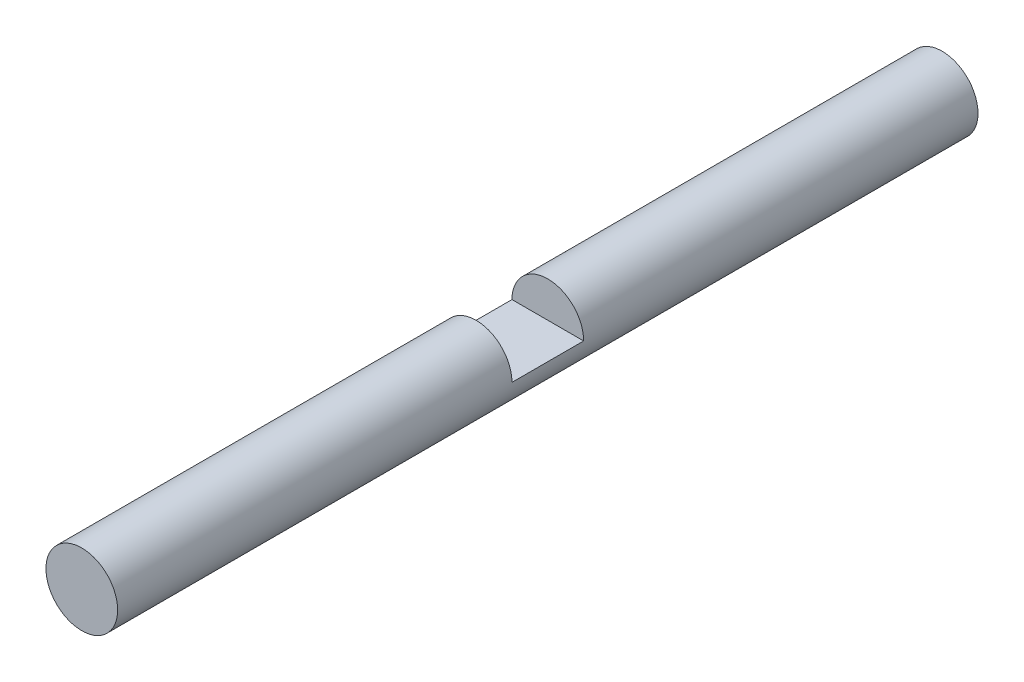
from build123d import *

# Parameters (mm, degrees)
BOSS_EXTRUDE1_DEPTH      = 30
BOSS_EXTRUDE1_DEPTH_BACK = 30
SKETCH1_R                = 2.5
SKETCH5_W                = 5
SKETCH5_H                = 5
CUT_EXTRUDE1_DEPTH       = 10


with BuildPart() as part:
    # Sketch1 → Boss-Extrude1 (new, two sides: drawn at the far end of the back side and taken through both)
    with BuildSketch(Plane.XY.offset(-BOSS_EXTRUDE1_DEPTH_BACK)):
        Circle(SKETCH1_R)
    extrude(amount=BOSS_EXTRUDE1_DEPTH + BOSS_EXTRUDE1_DEPTH_BACK)

    # Sketch5 → Cut-Extrude1 (cut)
    with BuildSketch(Plane(origin=(0, 0, 0), x_dir=(1, 0, 0), z_dir=(0, 1, 0))):
        Rectangle(SKETCH5_W, SKETCH5_H)
    extrude(amount=CUT_EXTRUDE1_DEPTH, mode=Mode.SUBTRACT)


solid = part.part
